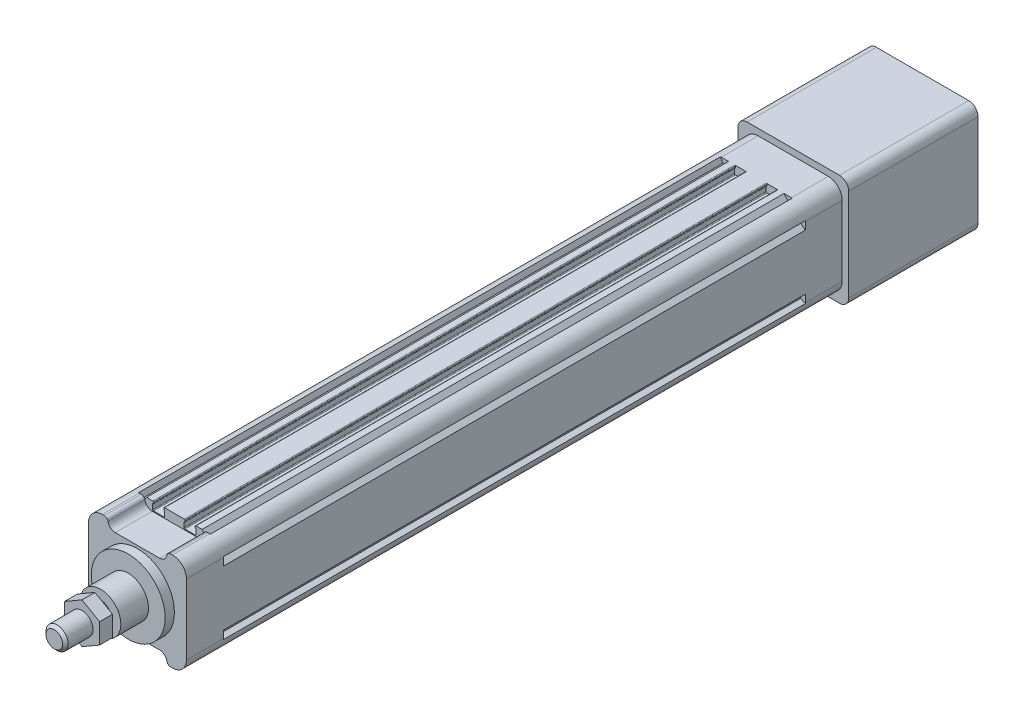
from build123d import *

# Parameters (mm, degrees)
SKETCH_1_R             = 2.1
EXTRUDE_1_DEPTH        = 315
EXTRUDE_2_DEPTH        = 20
SKETCH_7_R             = 20
EXTRUDE_3_DEPTH        = 5
SKETCH_9_R             = 11
EXTRUDE_4_DEPTH        = 15
SKETCH_10_R            = 6
EXTRUDE_5_DEPTH        = 25
EXTRUDE_START          = 20
EXTRUDE_6_DEPTH        = 20
EXTRUDE_7_DEPTH        = 70
SKETCH_14_R            = 19
CUT_EXTRUDE_2_DEPTH    = 70
HOLE_WIZARD_M6_1_D     = 5
HOLE_WIZARD_M6_1_DEPTH = 15
HOLE_WIZARD_M6_1_TIP   = 1.502151548
CHAMFER_1_SIZE         = 1.5
EXTRUDE_START_2        = 3
EXTRUDE_8_DEPTH        = 7


with BuildPart() as part:
    # 草图1 → 凸台-拉伸1 (new body)
    with BuildSketch(Plane.XY):
        with BuildLine():
            Line((-18.2, 24), (-19.443439638, 26.486879276))
            ThreePointArc((-19.443439638, 26.486879276), (-24.303300859, 24.303300859), (-26.486879276, 19.443439638))
            Line((-26.486879276, 19.443439638), (-24, 18.2))
            Line((-24, 18.2), (-24, 17.1))
            Line((-24, 17.1), (-26.5, 15))
            Line((-26.5, 15), (-26.5, -15))
            Line((-26.5, -15), (-24, -17.1))
            Line((-24, -17.1), (-24, -18.2))
            Line((-24, -18.2), (-26.486879276, -19.443439638))
            ThreePointArc((-26.486879276, -19.443439638), (-24.303300859, -24.303300859), (-19.443439638, -26.486879276))
            Line((-19.443439638, -26.486879276), (-18.2, -24))
            Line((-18.2, -24), (-17.1, -24))
            Line((-17.1, -24), (-15, -26.5))
            Line((-15, -26.5), (-11.65, -26.5))
            ThreePointArc((-11.65, -26.5), (-11.367157288, -26.382842712), (-11.25, -26.1))
            Line((-11.25, -26.1), (-11.25, -25.6))
            ThreePointArc((-11.25, -25.6), (-11.367157288, -25.317157288), (-11.65, -25.2))
            Line((-11.65, -25.2), (-11.75, -25.2))
            Line((-11.75, -25.2), (-11.75, -22.4))
            ThreePointArc((-11.75, -22.4), (-11.632842712, -22.117157288), (-11.35, -22))
            Line((-11.35, -22), (-5.65, -22))
            ThreePointArc((-5.65, -22), (-5.367157288, -22.117157288), (-5.25, -22.4))
            Line((-5.25, -22.4), (-5.25, -25.2))
            Line((-5.25, -25.2), (-5.35, -25.2))
            ThreePointArc((-5.35, -25.2), (-5.632842712, -25.317157288), (-5.75, -25.6))
            Line((-5.75, -25.6), (-5.75, -26.1))
            ThreePointArc((-5.75, -26.1), (-5.632842712, -26.382842712), (-5.35, -26.5))
            Line((-5.35, -26.5), (5.35, -26.5))
            ThreePointArc((5.35, -26.5), (5.632842712, -26.382842712), (5.75, -26.1))
            Line((5.75, -26.1), (5.75, -25.6))
            ThreePointArc((5.75, -25.6), (5.632842712, -25.317157288), (5.35, -25.2))
            Line((5.35, -25.2), (5.25, -25.2))
            Line((5.25, -25.2), (5.25, -22.4))
            ThreePointArc((5.25, -22.4), (5.367157288, -22.117157288), (5.65, -22))
            Line((5.65, -22), (11.35, -22))
            ThreePointArc((11.35, -22), (11.632842712, -22.117157288), (11.75, -22.4))
            Line((11.75, -22.4), (11.75, -25.2))
            Line((11.75, -25.2), (11.65, -25.2))
            ThreePointArc((11.65, -25.2), (11.367157288, -25.317157288), (11.25, -25.6))
            Line((11.25, -25.6), (11.25, -26.1))
            ThreePointArc((11.25, -26.1), (11.367157288, -26.382842712), (11.65, -26.5))
            Line((11.65, -26.5), (15, -26.5))
            Line((15, -26.5), (17.1, -24))
            Line((17.1, -24), (18.2, -24))
            Line((18.2, -24), (19.443439638, -26.486879276))
            ThreePointArc((19.443439638, -26.486879276), (24.303300859, -24.303300859), (26.486879276, -19.443439638))
            Line((26.486879276, -19.443439638), (24, -18.2))
            Line((24, -18.2), (24, -17.1))
            Line((24, -17.1), (26.5, -15))
            Line((26.5, -15), (26.5, 15))
            Line((26.5, 15), (24, 17.1))
            Line((24, 17.1), (24, 18.2))
            Line((24, 18.2), (26.486879276, 19.443439638))
            ThreePointArc((26.486879276, 19.443439638), (24.303300859, 24.303300859), (19.443439638, 26.486879276))
            Line((19.443439638, 26.486879276), (18.2, 24))
            Line((18.2, 24), (17.1, 24))
            Line((17.1, 24), (15, 26.5))
            Line((15, 26.5), (11.65, 26.5))
            ThreePointArc((11.65, 26.5), (11.367157288, 26.382842712), (11.25, 26.1))
            Line((11.25, 26.1), (11.25, 25.6))
            ThreePointArc((11.25, 25.6), (11.367157288, 25.317157288), (11.65, 25.2))
            Line((11.65, 25.2), (11.75, 25.2))
            Line((11.75, 25.2), (11.75, 22.4))
            ThreePointArc((11.75, 22.4), (11.632842712, 22.117157288), (11.35, 22))
            Line((11.35, 22), (5.65, 22))
            ThreePointArc((5.65, 22), (5.367157288, 22.117157288), (5.25, 22.4))
            Line((5.25, 22.4), (5.25, 25.2))
            Line((5.25, 25.2), (5.35, 25.2))
            ThreePointArc((5.35, 25.2), (5.632842712, 25.317157288), (5.75, 25.6))
            Line((5.75, 25.6), (5.75, 26.1))
            ThreePointArc((5.75, 26.1), (5.632842712, 26.382842712), (5.35, 26.5))
            Line((5.35, 26.5), (-5.35, 26.5))
            ThreePointArc((-5.35, 26.5), (-5.632842712, 26.382842712), (-5.75, 26.1))
            Line((-5.75, 26.1), (-5.75, 25.6))
            ThreePointArc((-5.75, 25.6), (-5.632842712, 25.317157288), (-5.35, 25.2))
            Line((-5.35, 25.2), (-5.25, 25.2))
            Line((-5.25, 25.2), (-5.25, 22.4))
            ThreePointArc((-5.25, 22.4), (-5.367157288, 22.117157288), (-5.65, 22))
            Line((-5.65, 22), (-11.35, 22))
            ThreePointArc((-11.35, 22), (-11.632842712, 22.117157288), (-11.75, 22.4))
            Line((-11.75, 22.4), (-11.75, 25.2))
            Line((-11.75, 25.2), (-11.65, 25.2))
            ThreePointArc((-11.65, 25.2), (-11.367157288, 25.317157288), (-11.25, 25.6))
            Line((-11.25, 25.6), (-11.25, 26.1))
            ThreePointArc((-11.25, 26.1), (-11.367157288, 26.382842712), (-11.65, 26.5))
            Line((-11.65, 26.5), (-15, 26.5))
            Line((-15, 26.5), (-17.1, 24))
            Line((-17.1, 24), (-18.2, 24))
        make_face()
        with Locations((19, 19)):
            Circle(SKETCH_1_R, mode=Mode.SUBTRACT)
        with Locations((19, -19)):
            Circle(SKETCH_1_R, mode=Mode.SUBTRACT)
        with Locations((-19, -19)):
            Circle(SKETCH_1_R, mode=Mode.SUBTRACT)
        with Locations((-19, 19)):
            Circle(SKETCH_1_R, mode=Mode.SUBTRACT)
        with BuildLine():
            Line((19.773719933, 3), (23.3, 3))
            Line((23.3, 3), (23.3, -3))
            Line((23.3, -3), (19.773719933, -3))
            ThreePointArc((19.773719933, -3), (0, -20), (-19.773719933, -3))
            Line((-19.773719933, -3), (-23.3, -3))
            Line((-23.3, -3), (-23.3, 3))
            Line((-23.3, 3), (-19.773719933, 3))
            ThreePointArc((-19.773719933, 3), (0, 20), (19.773719933, 3))
        make_face(mode=Mode.SUBTRACT)
    extrude(amount=EXTRUDE_1_DEPTH)

    # 草图6 → 凸台-拉伸2 (add)
    with BuildSketch(Plane.XY.offset(315)):
        with BuildLine():
            Line((-26.5, -19), (-26.5, 19))
            ThreePointArc((-26.5, 19), (-24.303300859, 24.303300859), (-19, 26.5))
            Line((-19, 26.5), (-17.916079783, 26.5))
            ThreePointArc((-17.916079783, 26.5), (-16.625085334, 26.027525232), (-15.944053189, 24.833333333))
            ThreePointArc((-15.944053189, 24.833333333), (-14.581988897, 22.444949537), (-12, 21.5))
            Line((-12, 21.5), (12, 21.5))
            ThreePointArc((12, 21.5), (14.581988897, 22.444949537), (15.944053189, 24.833333333))
            ThreePointArc((15.944053189, 24.833333333), (16.625085334, 26.027525232), (17.916079783, 26.5))
            Line((17.916079783, 26.5), (19, 26.5))
            ThreePointArc((19, 26.5), (24.303300859, 24.303300859), (26.5, 19))
            Line((26.5, 19), (26.5, -19))
            ThreePointArc((26.5, -19), (24.303300859, -24.303300859), (19, -26.5))
            Line((19, -26.5), (17.916079783, -26.5))
            ThreePointArc((17.916079783, -26.5), (16.625085334, -26.027525232), (15.944053189, -24.833333333))
            ThreePointArc((15.944053189, -24.833333333), (14.581988897, -22.444949537), (12, -21.5))
            Line((12, -21.5), (-12, -21.5))
            ThreePointArc((-12, -21.5), (-14.581988897, -22.444949537), (-15.944053189, -24.833333333))
            ThreePointArc((-15.944053189, -24.833333333), (-16.625085334, -26.027525232), (-17.916079783, -26.5))
            Line((-17.916079783, -26.5), (-19, -26.5))
            ThreePointArc((-19, -26.5), (-24.303300859, -24.303300859), (-26.5, -19))
        make_face()
    extrude(amount=EXTRUDE_2_DEPTH)

    # 草图7 → 凸台-拉伸3 (add)
    with BuildSketch(Plane.XY.offset(335)):
        Circle(SKETCH_7_R)
    extrude(amount=EXTRUDE_3_DEPTH)

    # 草图9 → 凸台-拉伸4 (add)
    with BuildSketch(Plane.XY.offset(340)):
        Circle(SKETCH_9_R)
    extrude(amount=EXTRUDE_4_DEPTH)

    # 草图10 → 凸台-拉伸5 (add)
    with BuildSketch(Plane.XY.offset(355)):
        Circle(SKETCH_10_R)
    extrude(amount=EXTRUDE_5_DEPTH)

    # 草图11 → 凸台-拉伸6 (add)
    with BuildSketch(Plane(origin=(0, 0, 0), x_dir=(-1, 0, 0), z_dir=(0, 0, -1)).offset(EXTRUDE_START)):
        with BuildLine():
            Line((-19, -26.5), (19, -26.5))
            ThreePointArc((19, -26.5), (24.303300859, -24.303300859), (26.5, -19))
            Line((26.5, -19), (26.5, 19))
            ThreePointArc((26.5, 19), (24.303300859, 24.303300859), (19, 26.5))
            Line((19, 26.5), (-19, 26.5))
            ThreePointArc((-19, 26.5), (-24.303300859, 24.303300859), (-26.5, 19))
            Line((-26.5, 19), (-26.5, -19))
            ThreePointArc((-26.5, -19), (-24.303300859, -24.303300859), (-19, -26.5))
        make_face()
    extrude(amount=-EXTRUDE_6_DEPTH)

    # 草图12 → 凸台-拉伸7 (add)
    with BuildSketch(Plane(origin=(0, 0, -20), x_dir=(-1, 0, 0), z_dir=(0, 0, -1))):
        with BuildLine():
            Line((-25, -30), (25, -30))
            ThreePointArc((25, -30), (28.535533906, -28.535533906), (30, -25))
            Line((30, -25), (30, 25))
            ThreePointArc((30, 25), (28.535533906, 28.535533906), (25, 30))
            Line((25, 30), (-25, 30))
            ThreePointArc((-25, 30), (-28.535533906, 28.535533906), (-30, 25))
            Line((-30, 25), (-30, -25))
            ThreePointArc((-30, -25), (-28.535533906, -28.535533906), (-25, -30))
        make_face()
    extrude(amount=EXTRUDE_7_DEPTH)

    # 草图14 → 切除-拉伸2 (cut)
    with BuildSketch(Plane(origin=(0, 0, -90), x_dir=(-1, 0, 0), z_dir=(0, 0, -1))):
        Circle(SKETCH_14_R)
    extrude(amount=-CUT_EXTRUDE_2_DEPTH, mode=Mode.SUBTRACT)

    # M6 螺纹孔1
    with Locations(Plane.ZY.offset(26.5)):
        with Locations((325, 11), (325, -11), (-10, 11), (-10, -11)):
            Hole(HOLE_WIZARD_M6_1_D / 2, depth=HOLE_WIZARD_M6_1_DEPTH)
            with Locations((0, 0, -(HOLE_WIZARD_M6_1_DEPTH + HOLE_WIZARD_M6_1_TIP / 2))):  # 118° drill point
                Cone(0, HOLE_WIZARD_M6_1_D / 2, HOLE_WIZARD_M6_1_TIP, mode=Mode.SUBTRACT)

    # 倒角1
    chamfer_1_edges = [part.edges().sort_by_distance(p)[0] for p in [
        (-6, 0, 380),
    ]]
    chamfer(chamfer_1_edges, length=CHAMFER_1_SIZE)

    # 草图17 → 凸台-拉伸8 (add)
    with BuildSketch(Plane.XY.offset(355).offset(EXTRUDE_START_2)):
        Polygon((0, 10.969655115), (-9.5, 5.484827557), (-9.5, -5.484827557), (0, -10.969655115), (9.5, -5.484827557), (9.5, 5.484827557), align=None)
    extrude(amount=EXTRUDE_8_DEPTH)


solid = part.part
